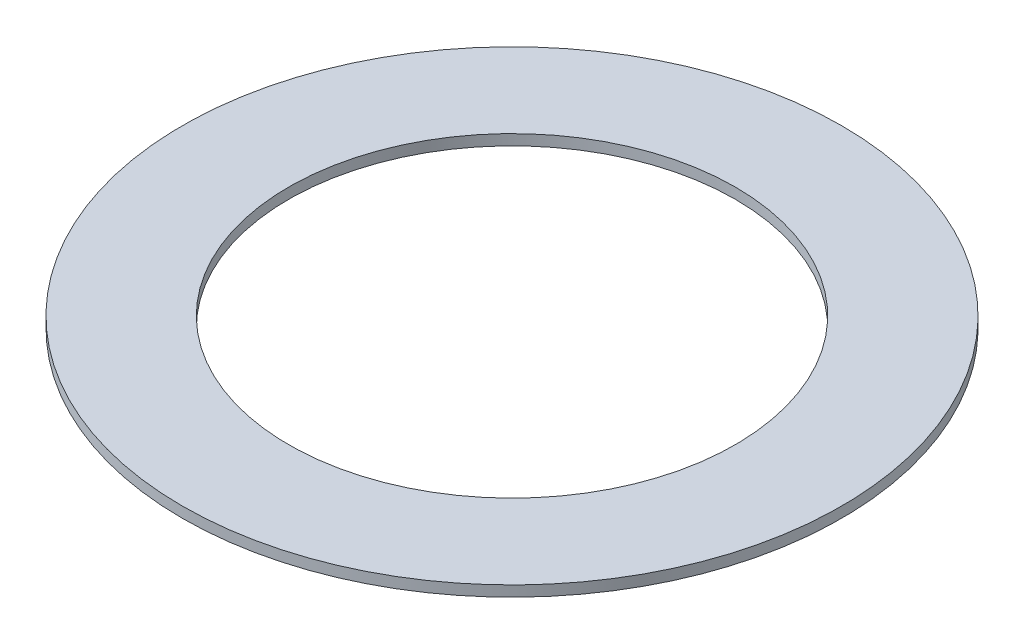
from build123d import *


with BuildPart() as part:
    # Sketch3 → Revolve1 (revolve)
    with BuildSketch(Plane.XY, mode=Mode.PRIVATE) as revolve1_sk:
        Polygon((10.5, -0.25), (11, -0.25), (11, 0), (15, 0), (15, -0.25), (15.5, -0.25), (15.5, 0.25), (10.5, 0.25), align=None)
    revolve(revolve1_sk.sketch.rotate(Axis((0, 0, 0), (0, 1, 0)), 90), axis=Axis((0, 0, 0), (0, 1, 0)))


solid = part.part
